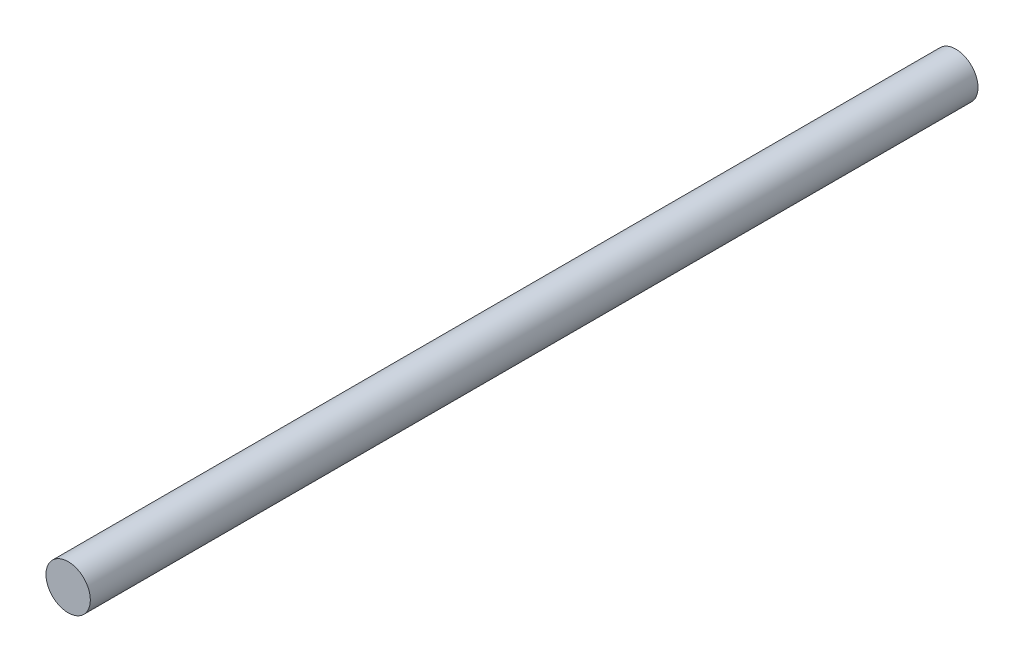
from build123d import *

# Parameters (mm, degrees)
TIE_STUD_START = -33
SKETCH_1_R     = 2
TIE_STUD_DEPTH = 80


with BuildPart() as part:
    # Эскиз1 → Tie_stud (new body)
    with BuildSketch(Plane.XY.offset(TIE_STUD_START)):
        Circle(SKETCH_1_R)
    extrude(amount=TIE_STUD_DEPTH)


solid = part.part
